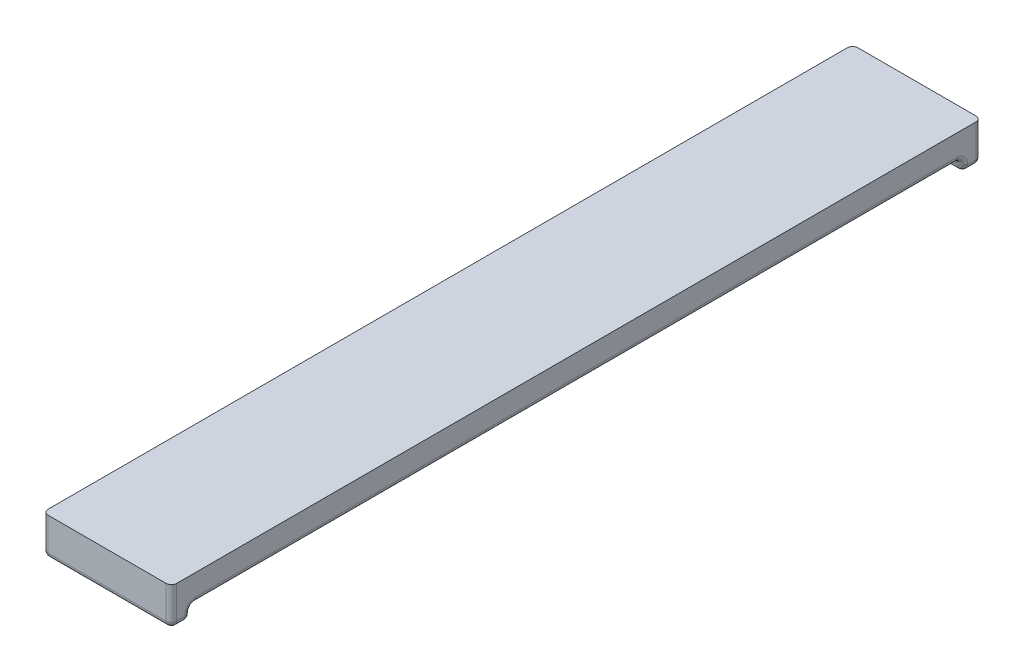
from build123d import *

# Parameters (mm, degrees)
BOSS_EXTRUDE1_DEPTH = 1.75
SKETCH2_W           = 8.459553448
SKETCH2_H           = 1.25
BOSS_EXTRUDE2_DEPTH = 0.75
BOSS_EXTRUDE3_DEPTH = 1.25
LPATTERN1_COUNT     = 10
LPATTERN1_PITCH     = 5.068
FILLET1_R           = 0.35


with BuildPart() as part:
    # Sketch1 → Boss-Extrude1 (new body)
    with BuildSketch(Plane(origin=(0, 0, 0), x_dir=(1, 0, 0), z_dir=(0, 1, 0))):
        Polygon((-17.603069868, -25.4), (-17.603069868, 25.4), (-17.603069868, 26.65), (-9.14351642, 26.65), (-9.14351642, 25.4), (-9.14351642, -25.4), (-9.14351642, -26.65), (-17.603069868, -26.65), align=None)
    extrude(amount=BOSS_EXTRUDE1_DEPTH)

    # Sketch2 → Boss-Extrude2 (add)
    with BuildSketch(Plane.XZ):
        with Locations((-13.373293144, 26.025)):
            Rectangle(SKETCH2_W, SKETCH2_H)
        with Locations((-13.373293144, -26.025)):
            Rectangle(SKETCH2_W, SKETCH2_H)
    extrude(amount=BOSS_EXTRUDE2_DEPTH)

    # Sketch3 → Boss-Extrude3 (add)
    with BuildSketch(Plane.XZ):
        with BuildLine():
            Line((-17.603069868, -24.3), (-12.103069868, -24.3))
            ThreePointArc((-12.103069868, -24.3), (-10.603069868, -22.8), (-12.103069868, -21.3))
            Line((-12.103069868, -21.3), (-17.603069868, -21.3))
            Line((-17.603069868, -21.3), (-17.603069868, -24.3))
        make_face()
    boss_extrude3 = extrude(amount=BOSS_EXTRUDE3_DEPTH)

    # LPattern1: Boss-Extrude3 ×10
    with Locations(*[(0, 0, i * LPATTERN1_PITCH) for i in range(1, LPATTERN1_COUNT)]):
        add(boss_extrude3)

    # Fillet1
    fillet1_edges = [part.edges().sort_by_distance(p)[0] for p in [
        (-14.853069868, -1.25, -14.164),
        (-10.603069868, -1.25, -12.664),
        (-14.853069868, -1.25, -11.164),
        (-17.603069868, 0, -5.062),
        (-17.603069868, -0.625, -6.096),
        (-14.853069868, 0, -9.096),
        (-17.603069868, -0.625, -9.096),
        (-10.603069868, 0, -7.596),
        (-14.853069868, 0, -6.096),
        (-17.603069868, -1.25, -7.596),
        (-14.853069868, -1.25, -9.096),
        (-10.603069868, -1.25, -7.596),
        (-14.853069868, -1.25, -6.096),
        (-17.603069868, 0, 0.006),
        (-17.603069868, -0.625, -1.028),
        (-14.853069868, 0, -4.028),
        (-17.603069868, -0.625, -4.028),
        (-10.603069868, 0, -2.528),
        (-14.853069868, 0, -1.028),
        (-17.603069868, -1.25, -2.528),
        (-14.853069868, -1.25, -4.028),
        (-10.603069868, -1.25, -2.528),
        (-14.853069868, -1.25, -1.028),
        (-17.603069868, 0, 5.074),
        (-17.603069868, -0.625, 4.04),
        (-14.853069868, 0, 1.04),
        (-17.603069868, -0.625, 1.04),
        (-10.603069868, 0, 2.54),
        (-14.853069868, 0, 4.04),
        (-17.603069868, -1.25, 2.54),
        (-14.853069868, -1.25, 1.04),
        (-10.603069868, -1.25, 2.54),
        (-14.853069868, -1.25, 4.04),
        (-17.603069868, 0, 10.142),
        (-17.603069868, -0.625, 9.108),
        (-14.853069868, 0, 6.108),
        (-17.603069868, -0.625, 6.108),
        (-10.603069868, 0, 7.608),
        (-14.853069868, 0, 9.108),
        (-17.603069868, -1.25, 7.608),
        (-14.853069868, -1.25, 6.108),
        (-10.603069868, -1.25, 7.608),
        (-14.853069868, -1.25, 9.108),
        (-17.603069868, 0.5, -26.65),
        (-9.14351642, 0.5, -26.65),
        (-9.14351642, 0.5, 26.65),
        (-17.603069868, 0.5, 26.65),
        (-17.603069868, 0, 15.21),
        (-17.603069868, -0.625, 14.176),
        (-14.853069868, 0, 11.176),
        (-17.603069868, -0.625, 11.176),
        (-10.603069868, 0, 12.676),
        (-14.853069868, 0, 14.176),
        (-17.603069868, -1.25, 12.676),
        (-14.853069868, -1.25, 11.176),
        (-10.603069868, -1.25, 12.676),
        (-14.853069868, -1.25, 14.176),
        (-17.603069868, 0, 20.278),
        (-17.603069868, -0.625, 19.244),
        (-14.853069868, 0, 16.244),
        (-17.603069868, -0.625, 16.244),
        (-10.603069868, 0, 17.744),
        (-14.853069868, 0, 19.244),
        (-17.603069868, -1.25, 17.744),
        (-14.853069868, -1.25, 16.244),
        (-10.603069868, -1.25, 17.744),
        (-14.853069868, -1.25, 19.244),
        (-17.603069868, 0, 24.856),
        (-17.603069868, -0.625, 24.312),
        (-14.853069868, 0, 21.312),
        (-17.603069868, -0.625, 21.312),
        (-10.603069868, 0, 22.812),
        (-14.853069868, 0, 24.312),
        (-17.603069868, -1.25, 22.812),
        (-14.853069868, -1.25, 21.312),
        (-10.603069868, -1.25, 22.812),
        (-14.853069868, -1.25, 24.312),
        (-9.14351642, 0, 0),
        (-9.14351642, -0.375, 25.4),
        (-13.373293144, 0, 25.4),
        (-17.603069868, -0.375, 25.4),
        (-9.14351642, -0.75, 26.025),
        (-13.373293144, -0.75, 26.65),
        (-17.603069868, -0.75, 26.025),
        (-13.373293144, -0.75, 25.4),
        (-17.603069868, 0, -24.85),
        (-13.373293144, 0, -25.4),
        (-9.14351642, -0.375, -25.4),
        (-17.603069868, -0.375, -25.4),
        (-9.14351642, -0.75, -26.025),
        (-13.373293144, -0.75, -25.4),
        (-17.603069868, -0.75, -26.025),
        (-13.373293144, -0.75, -26.65),
        (-17.603069868, 0, -20.266),
        (-17.603069868, -0.625, -21.3),
        (-14.853069868, 0, -24.3),
        (-17.603069868, -0.625, -24.3),
        (-10.603069868, 0, -22.8),
        (-14.853069868, 0, -21.3),
        (-17.603069868, -1.25, -22.8),
        (-14.853069868, -1.25, -24.3),
        (-10.603069868, -1.25, -22.8),
        (-14.853069868, -1.25, -21.3),
        (-17.603069868, 0, -15.198),
        (-17.603069868, -0.625, -16.232),
        (-14.853069868, 0, -19.232),
        (-17.603069868, -0.625, -19.232),
        (-10.603069868, 0, -17.732),
        (-14.853069868, 0, -16.232),
        (-17.603069868, -1.25, -17.732),
        (-14.853069868, -1.25, -19.232),
        (-10.603069868, -1.25, -17.732),
        (-14.853069868, -1.25, -16.232),
        (-17.603069868, 0, -10.13),
        (-17.603069868, -0.625, -11.164),
        (-14.853069868, 0, -14.164),
        (-17.603069868, -0.625, -14.164),
        (-10.603069868, 0, -12.664),
        (-14.853069868, 0, -11.164),
        (-17.603069868, -1.25, -12.664),
    ]]
    fillet(fillet1_edges, radius=FILLET1_R)


solid = part.part
